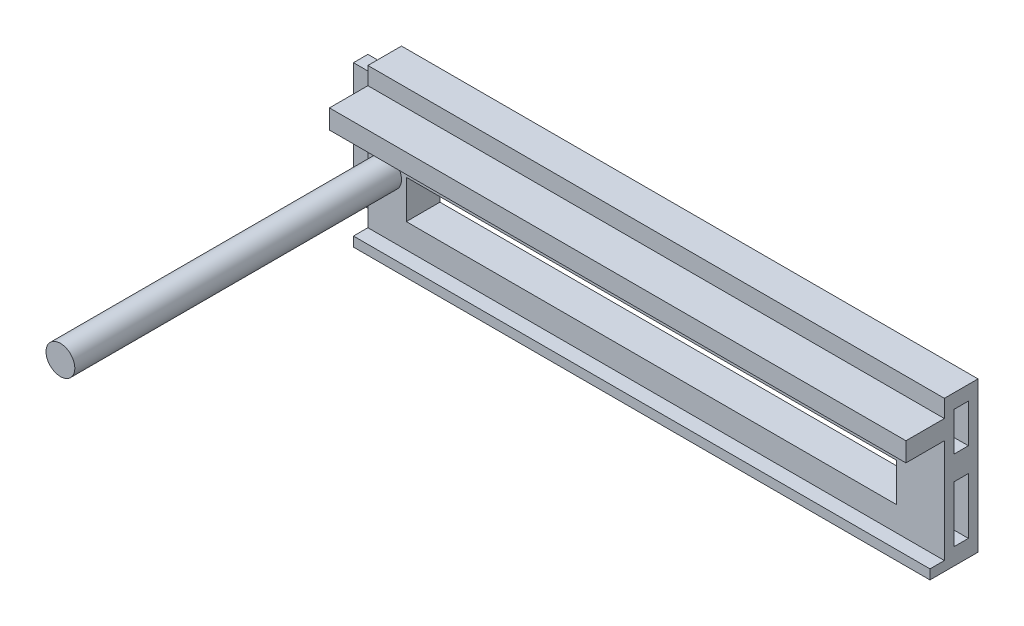
from build123d import *

# Parameters (mm, degrees)
SKETCH1_W               = 120
SKETCH1_H               = 31.25
BOSS_EXTRUDE1_DEPTH     = 7
SKETCH2_W               = 120
SKETCH2_H               = 4
SKETCH2_H_2             = 2
BOSS_EXTRUDE2_DEPTH     = 8
CUT_EXTRUDE1_DEPTH      = 125.260059955
CUT_EXTRUDE1_DEPTH_BACK = 125.260059955
SKETCH3_W               = 102
SKETCH3_H               = 8
SKETCH3_H_2             = 3.5
SKETCH4_W               = 3
SKETCH4_H               = 8.090611825
SKETCH4_H_2             = 10.659388175
BOSS_EXTRUDE3_DEPTH     = 5
SKETCH5_W               = 3
SKETCH5_H               = 8.0580149
SKETCH5_H_2             = 11.6919851
CUT_EXTRUDE2_DEPTH      = 5
CUT_EXTRUDE3_REACH      = 126.906
SKETCH6_W               = 5
SKETCH6_H               = 2
SKETCH7_R               = 3
BOSS_EXTRUDE4_DEPTH     = 68


with BuildPart() as part:
    # Sketch1 → Boss-Extrude1 (new body)
    with BuildSketch(Plane.XY):
        with Locations((60, 15.625)):
            Rectangle(SKETCH1_W, SKETCH1_H)
    extrude(amount=BOSS_EXTRUDE1_DEPTH)

    # Sketch2 → Boss-Extrude2 (add)
    with BuildSketch(Plane.XY.offset(7)):
        with Locations((60, 25.6)):
            Rectangle(SKETCH2_W, SKETCH2_H)
        with Locations((60, 1)):
            Rectangle(SKETCH2_W, SKETCH2_H_2)
    extrude(amount=BOSS_EXTRUDE2_DEPTH)

    # Sketch3 → Cut-Extrude1 (cut, two sides: drawn at the far end of the back side and taken through both)
    with BuildSketch(Plane.XY.offset(7).offset(-CUT_EXTRUDE1_DEPTH_BACK)):
        with Locations((59, 11.1)):
            Rectangle(SKETCH3_W, SKETCH3_H)
        with Locations((59, 21.85)):
            Rectangle(SKETCH3_W, SKETCH3_H_2)
    extrude(amount=CUT_EXTRUDE1_DEPTH + CUT_EXTRUDE1_DEPTH_BACK, mode=Mode.SUBTRACT)

    # Sketch4 → Boss-Extrude3 (add)
    with BuildSketch(Plane.ZY):
        with Locations((3.5, 24.204694088)):
            Rectangle(SKETCH4_W, SKETCH4_H)
        with Locations((3.5, 8.829694088)):
            Rectangle(SKETCH4_W, SKETCH4_H_2)
    extrude(amount=BOSS_EXTRUDE3_DEPTH)

    # Sketch5 → Cut-Extrude2 (cut)
    with BuildSketch(Plane(origin=(120, 0, 0), x_dir=(0, 0, -1), z_dir=(1, 0, 0))):
        with Locations((-3.5, 24.22099255)):
            Rectangle(SKETCH5_W, SKETCH5_H)
        with Locations((-3.5, 9.34599255)):
            Rectangle(SKETCH5_W, SKETCH5_H_2)
    extrude(amount=-CUT_EXTRUDE2_DEPTH, mode=Mode.SUBTRACT)

    # Sketch6 → Cut-Extrude3 (cut, up to next)
    with BuildSketch(Plane.ZY, mode=Mode.PRIVATE) as cut_extrude3_sk1:
        with Locations((12.5, 1)):
            Rectangle(SKETCH6_W, SKETCH6_H)
    cut_extrude3_tool1 = extrude(cut_extrude3_sk1.sketch, amount=-CUT_EXTRUDE3_REACH, mode=Mode.PRIVATE) & part.part
    add(cut_extrude3_tool1.solids().sort_by_distance((0, 1, 12.5))[0], mode=Mode.SUBTRACT)

    # Sketch7 → Boss-Extrude4 (add)
    with BuildSketch(Plane.XY.offset(7)):
        with Locations((4, 14.159388175)):
            Circle(SKETCH7_R)
    extrude(amount=BOSS_EXTRUDE4_DEPTH)


solid = part.part
